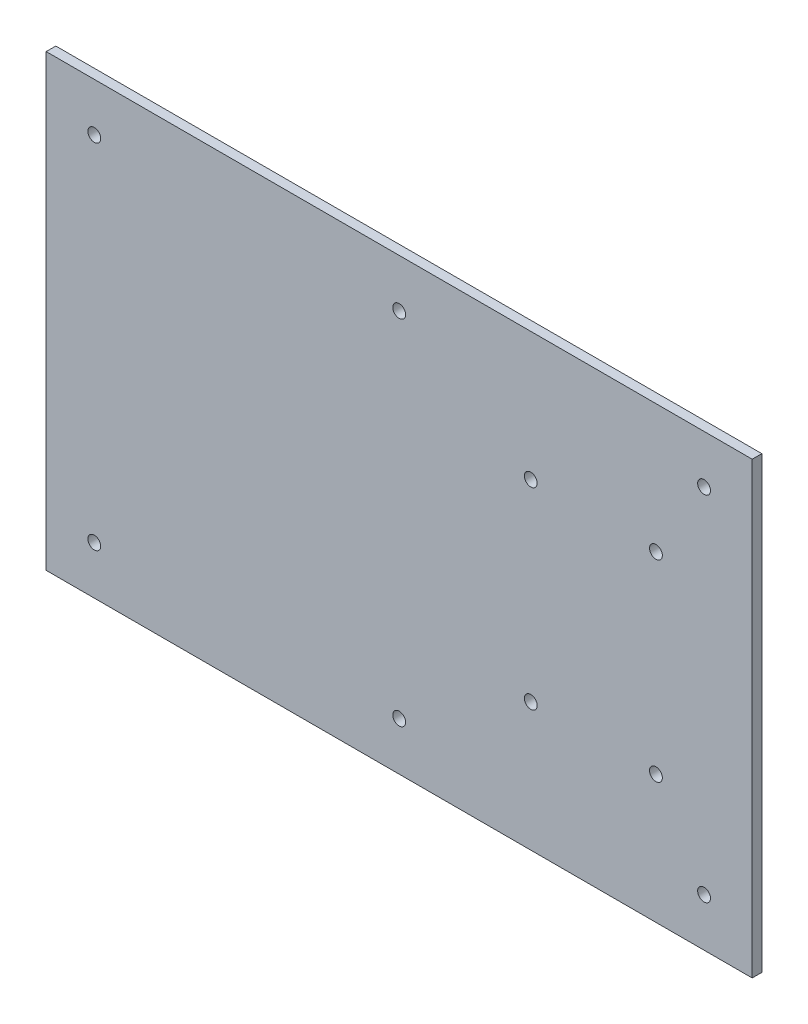
from build123d import *

# Parameters (mm, degrees)
IZIM1_W                     = 220
IZIM1_H                     = 140
Y_KSEKLIK_EKSTR_ZYON1_DEPTH = 3
IZIM2_R                     = 2
KES_EKSTR_ZYON1_DEPTH       = 3
IZIM4_R                     = 2
KES_EKSTR_ZYON3_DEPTH       = 10


with BuildPart() as part:
    # Çizim1 → Yükseklik-Ekstrüzyon1 (new body)
    with BuildSketch(Plane.XY):
        with Locations((110, 70)):
            Rectangle(IZIM1_W, IZIM1_H)
    extrude(amount=Y_KSEKLIK_EKSTR_ZYON1_DEPTH)

    # Çizim2 → Kes-Ekstrüzyon1 (cut)
    with BuildSketch(Plane.XY.offset(3)):
        with Locations((15, 125)):
            Circle(IZIM2_R)
        with Locations((205, 125)):
            Circle(IZIM2_R)
        with Locations((110, 125)):
            Circle(IZIM2_R)
        with Locations(Location((205, 15, 0), (0, 0, 180))):
            Circle(IZIM2_R)
        with Locations(Location((110, 15, 0), (0, 0, 180))):
            Circle(IZIM2_R)
        with Locations(Location((15, 15, 0), (0, 0, 180))):
            Circle(IZIM2_R)
    extrude(amount=-KES_EKSTR_ZYON1_DEPTH, mode=Mode.SUBTRACT)

    # Çizim4 → Kes-Ekstrüzyon3 (cut)
    with BuildSketch(Plane.XY.offset(3)):
        with Locations((190, 40)):
            Circle(IZIM4_R)
        with Locations((151, 40)):
            Circle(IZIM4_R)
        with Locations(Location((190, 100, 0), (0, 0, 180))):
            Circle(IZIM4_R)
        with Locations(Location((151, 100, 0), (0, 0, 180))):
            Circle(IZIM4_R)
    extrude(amount=-KES_EKSTR_ZYON3_DEPTH, mode=Mode.SUBTRACT)


solid = part.part
